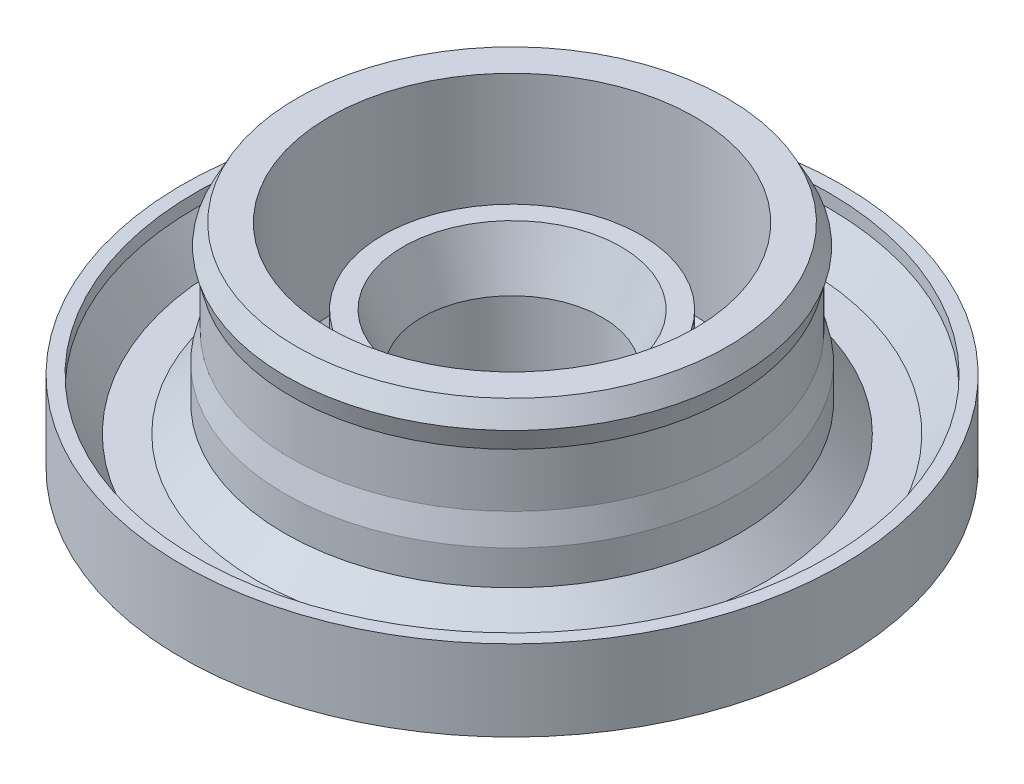
from build123d import *

# Parameters (mm, degrees)
SKETCH4_R           = 3.85
SKETCH4_R_2         = 3.35
BOSS_EXTRUDE1_DEPTH = 2.1
FILLET1_R           = 0.5
FILLET2_R           = 0.2


with BuildPart() as part:
    # Sketch1 → Revolve1 (revolve)
    with BuildSketch(Plane.XY, mode=Mode.PRIVATE) as revolve1_sk:
        Polygon((-12.25, 7.1), (-4.45, 7.1), (-4.45, 0), (-6, 0), (-6, 4.1), (-12.25, 4.1), align=None)
    revolve(revolve1_sk.sketch.rotate(Axis((0, 0, 0), (0, 1, 0)), 270), axis=Axis((0, 0, 0), (0, 1, 0)))

    # Sketch2 → Cut-Revolve1 (revolve, cut)
    with BuildSketch(Plane.XY, mode=Mode.PRIVATE) as cut_revolve1_sk:
        Polygon((-11.75, 7.1), (-11.75, 6.6), (-10.769709447, 5.2), (-6.8, 5.2), (-6.8, 4.8), (0, 4.8), (0, 10.778180343), (-11.75, 10.778180343), align=None)
    revolve(cut_revolve1_sk.sketch.rotate(Axis((0, 4.8, 0), (0, 1, 0)), 270), axis=Axis((0, 4.8, 0), (0, 1, 0)), mode=Mode.SUBTRACT)

    # Sketch3 → Revolve2 (revolve)
    with BuildSketch(Plane.XY, mode=Mode.PRIVATE) as revolve2_sk:
        Polygon((-4.8, 9.2), (-4.8, 4.1), (-3.35, 4.1), (-3.35, 7.276765806), (-4.05, 9.2), align=None)
    revolve(revolve2_sk.sketch.rotate(Axis((0, 0, 0), (0, 1, 0)), 270), axis=Axis((0, 0, 0), (0, 1, 0)))

    # Sketch4 → Boss-Extrude1 (add)
    with BuildSketch(Plane.XZ.offset(-4.1)):
        with Locations(Location((0, 0, 0), (0, 0, 90))):
            Circle(SKETCH4_R)
        with Locations(Location((0, 0, 0), (0, 0, 270))):
            Circle(SKETCH4_R_2, mode=Mode.SUBTRACT)
    extrude(amount=BOSS_EXTRUDE1_DEPTH)

    # Sketch5 → Revolve3 (revolve)
    with BuildSketch(Plane.XY, mode=Mode.PRIVATE) as revolve3_sk:
        Polygon((-8, 12), (-6.8, 12), (-6.8, 5.2), (-9.469709447, 5.2), (-8.45, 6.219709447), (-8.45, 7.5), (-8.2, 8.5), (-8.2, 10.5), (-8.4, 11.246410162), align=None)
    revolve(revolve3_sk.sketch.rotate(Axis((0, 0, 0), (0, 1, 0)), 270), axis=Axis((0, 0, 0), (0, 1, 0)))

    # Sketch6 → Revolve4 (revolve)
    with BuildSketch(Plane.XY, mode=Mode.PRIVATE) as revolve4_sk:
        Polygon((-6.8, 5.6), (-6, 4.8), (-6, 4.543753343), (-7.17505457, 4.543753343), (-7.17505457, 5.6), align=None)
    revolve(revolve4_sk.sketch.rotate(Axis((0, 0, 0), (0, 1, 0)), 270), axis=Axis((0, 0, 0), (0, 1, 0)))

    # Fillet1
    fillet1_edges = [part.edges().sort_by_distance(p)[0] for p in [
        (0, 0, 6),
    ]]
    fillet(fillet1_edges, radius=FILLET1_R)

    # Fillet2
    fillet2_edges = [part.edges().sort_by_distance(p)[0] for p in [
        (0, 2, -3.85),
    ]]
    fillet(fillet2_edges, radius=FILLET2_R)


solid = part.part
